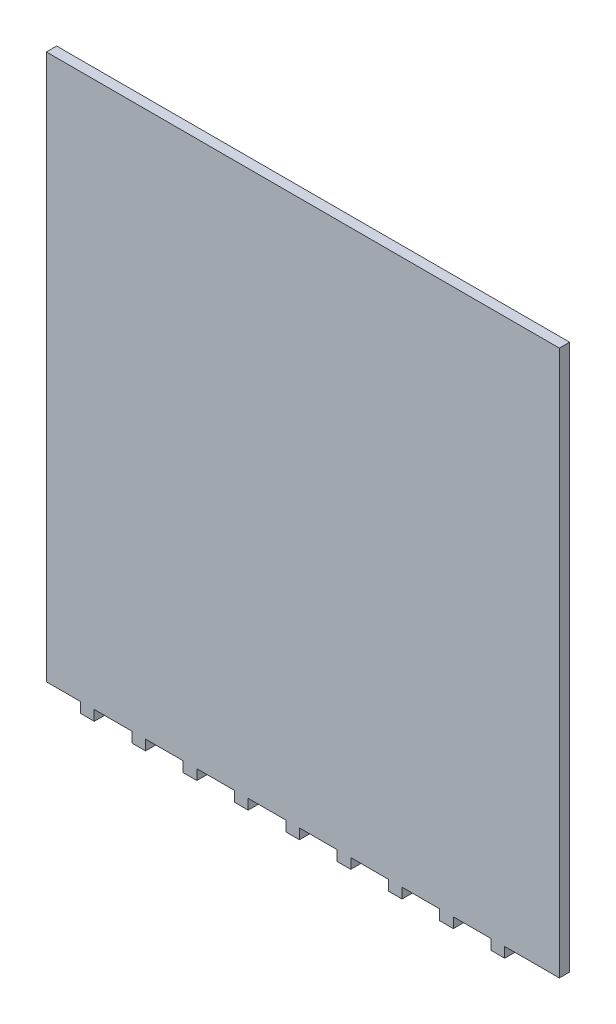
from build123d import *

# Parameters (mm, degrees)
SKETCH1_W           = 300
SKETCH1_H           = 325
BOSS_EXTRUDE1_DEPTH = 6
SKETCH2_W           = 22
SKETCH2_H           = 6
SKETCH2_W_2         = 20
SKETCH2_W_3         = 32
CUT_EXTRUDE1_DEPTH  = 443.335845258


with BuildPart() as part:
    # Sketch1 → Boss-Extrude1 (new body)
    with BuildSketch(Plane.XY):
        with Locations((150, -162.5)):
            Rectangle(SKETCH1_W, SKETCH1_H)
    extrude(amount=BOSS_EXTRUDE1_DEPTH)

    # Sketch2 → Cut-Extrude1 (cut, through all)
    with BuildSketch(Plane.XY.offset(6)):
        with Locations((39, -322)):
            Rectangle(SKETCH2_W, SKETCH2_H)
        with Locations((10, -322)):
            Rectangle(SKETCH2_W_2, SKETCH2_H)
        with Locations((69, -322)):
            Rectangle(SKETCH2_W, SKETCH2_H)
        with Locations((99, -322)):
            Rectangle(SKETCH2_W, SKETCH2_H)
        with Locations((129, -322)):
            Rectangle(SKETCH2_W, SKETCH2_H)
        with Locations((159, -322)):
            Rectangle(SKETCH2_W, SKETCH2_H)
        with Locations((189, -322)):
            Rectangle(SKETCH2_W, SKETCH2_H)
        with Locations((219, -322)):
            Rectangle(SKETCH2_W, SKETCH2_H)
        with Locations((249, -322)):
            Rectangle(SKETCH2_W, SKETCH2_H)
        with Locations((284, -322)):
            Rectangle(SKETCH2_W_3, SKETCH2_H)
    extrude(amount=-CUT_EXTRUDE1_DEPTH, mode=Mode.SUBTRACT)


solid = part.part
